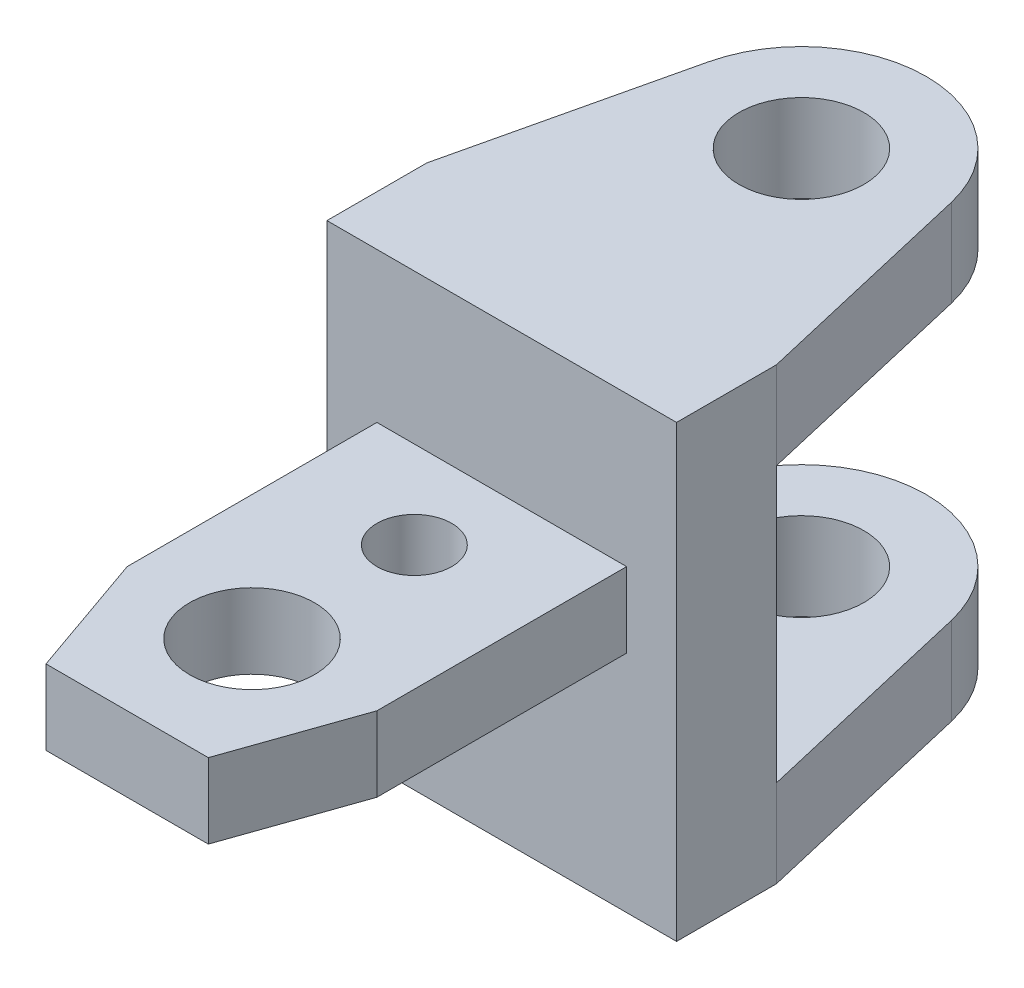
from build123d import *

# Parameters (mm, degrees)
SKETCH1_W           = 28
SKETCH1_H           = 36
BOSS_EXTRUDE2_DEPTH = 8
SKETCH3_R           = 5
BOSS_EXTRUDE3_DEPTH = 7
SKETCH4_W           = 30
SKETCH4_H           = 6
BOSS_EXTRUDE4_DEPTH = 10
CHAMFER1_SIZE       = 10
CHAMFER1_SIZE2      = 3.5
CHAMFER2_SIZE       = 3.5
CHAMFER2_SIZE2      = 10
CUT_EXTRUDE1_REACH  = 45.909
SKETCH5_R           = 3
SKETCH5_R_2         = 5


with BuildPart() as part:
    # Sketch1 → Boss-Extrude2 (new body)
    with BuildSketch(Plane.XY):
        Rectangle(SKETCH1_W, SKETCH1_H)
    extrude(amount=-BOSS_EXTRUDE2_DEPTH)

    # Sketch3 → Boss-Extrude3 (add)
    with BuildSketch(Plane(origin=(0, 18, 0), x_dir=(1, 0, 0), z_dir=(0, 1, 0))):
        with BuildLine():
            Line((-14, 8), (14, 8))
            Line((14, 8), (9.738641784, 26.271311561))
            ThreePointArc((9.738641784, 26.271311561), (0, 34), (-9.738641784, 26.271311561))
            Line((-9.738641784, 26.271311561), (-14, 8))
        make_face()
        with Locations(Location((0, 24, 0), (0, 0, 270))):
            Circle(SKETCH3_R, mode=Mode.SUBTRACT)
    boss_extrude3 = extrude(amount=-BOSS_EXTRUDE3_DEPTH)

    # Mirror1: Boss-Extrude3 across plane
    add(boss_extrude3.mirror(Plane.ZX))

    # Sketch4 → Boss-Extrude4 (add, symmetric)
    with BuildSketch(Plane(origin=(0, 0, 0), x_dir=(0, 0, -1), z_dir=(1, 0, 0))):
        with Locations((-15, 3)):
            Rectangle(SKETCH4_W, SKETCH4_H)
    extrude(amount=BOSS_EXTRUDE4_DEPTH, both=True)

    # Chamfer1
    chamfer1_edges = [part.edges().sort_by_distance(p)[0] for p in [
        (-10, 3, 30),
    ]]
    chamfer1_side = [part.faces().sort_by_distance(p)[0] for p in [
        (-10, 3, 15),
    ]]
    chamfer(chamfer1_edges, length=CHAMFER1_SIZE, length2=CHAMFER1_SIZE2, reference=chamfer1_side[0])

    # Chamfer2
    chamfer2_edges = [part.edges().sort_by_distance(p)[0] for p in [
        (10, 3, 30),
    ]]
    chamfer2_side = [part.faces().sort_by_distance(p)[0] for p in [
        (1.75, 3, 30),
    ]]
    chamfer(chamfer2_edges, length=CHAMFER2_SIZE, length2=CHAMFER2_SIZE2, reference=chamfer2_side[0])

    # Sketch5 → Cut-Extrude1 (cut, up to next)
    with BuildSketch(Plane(origin=(0, 6, 0), x_dir=(1, 0, 0), z_dir=(0, 1, 0)), mode=Mode.PRIVATE) as cut_extrude1_sk1:
        with Locations(Location((0, -7, 0), (0, 0, 270))):
            Circle(SKETCH5_R)
    cut_extrude1_tool1 = extrude(cut_extrude1_sk1.sketch, amount=-CUT_EXTRUDE1_REACH, mode=Mode.PRIVATE) & part.part
    # Sketch5 → Cut-Extrude1 (cut, up to next)
    with BuildSketch(Plane(origin=(0, 6, 0), x_dir=(1, 0, 0), z_dir=(0, 1, 0)), mode=Mode.PRIVATE) as cut_extrude1_sk2:
        with Locations(Location((0, -20, 0), (0, 0, 270))):
            Circle(SKETCH5_R_2)
    cut_extrude1_tool2 = extrude(cut_extrude1_sk2.sketch, amount=-CUT_EXTRUDE1_REACH, mode=Mode.PRIVATE) & part.part
    add(cut_extrude1_tool1.solids().sort_by_distance((0, 6, 7))[0], mode=Mode.SUBTRACT)
    add(cut_extrude1_tool2.solids().sort_by_distance((0, 6, 20))[0], mode=Mode.SUBTRACT)


solid = part.part
